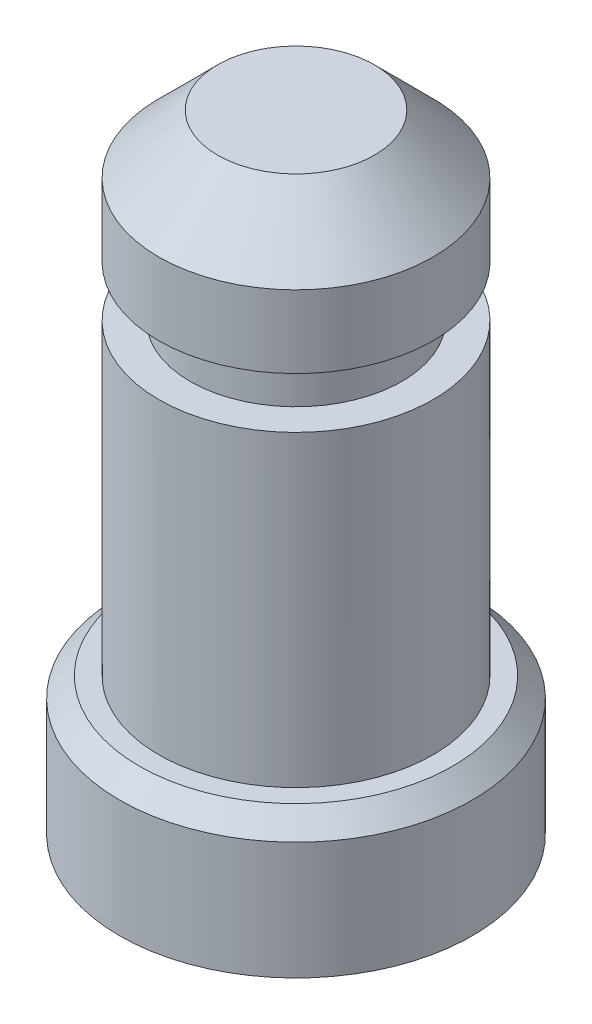
from build123d import *

# Parameters (mm, degrees)
SKETCH_1_R             = 3.5
EXTRUDE_1_DEPTH        = 8
SKETCH_2_W             = 1
SKETCH_2_H             = 3.5
HOLE_WIZARD_M4_1_D     = 3.3
HOLE_WIZARD_M4_1_DEPTH = 10.1
HOLE_WIZARD_M4_1_TIP   = 0.991420021
CHAMFER_1_SIZE         = 1.5
SKETCH_6_W             = 0.8
SKETCH_6_H             = 1.3
CHAMFER_2_SIZE         = 0.5


with BuildPart() as part:
    # 草图1 → 凸台-拉伸1 (new, symmetric)
    with BuildSketch(Plane(origin=(0, 0, 0), x_dir=(1, 0, 0), z_dir=(0, 1, 0))):
        with Locations(Location((0, 0, 0), (0, 0, 270))):
            Circle(SKETCH_1_R)
    extrude(amount=EXTRUDE_1_DEPTH, both=True)

    # 草图2 → 旋转1 (revolve)
    with BuildSketch(Plane.XY, mode=Mode.PRIVATE) as revolve_1_sk:
        with Locations((4, -6.25)):
            Rectangle(SKETCH_2_W, SKETCH_2_H)
    revolve(revolve_1_sk.sketch.rotate(Axis((0, 8, 0), (0, -1, 0)), 270), axis=Axis((0, 8, 0), (0, -1, 0)))

    # M4 螺纹孔1
    with Locations(Plane(origin=(0, -8, 0), x_dir=(-1, 0, 0), z_dir=(0, -1, 0))):
        with Locations((0, 0)):
            Hole(HOLE_WIZARD_M4_1_D / 2, depth=HOLE_WIZARD_M4_1_DEPTH)
            with Locations((0, 0, -(HOLE_WIZARD_M4_1_DEPTH + HOLE_WIZARD_M4_1_TIP / 2))):  # 118° drill point
                Cone(0, HOLE_WIZARD_M4_1_D / 2, HOLE_WIZARD_M4_1_TIP, mode=Mode.SUBTRACT)

    # 倒角1
    chamfer_1_edges = [part.edges().sort_by_distance(p)[0] for p in [
        (0, 8, -3.5),
    ]]
    chamfer(chamfer_1_edges, length=CHAMFER_1_SIZE)

    # 草图6 → 切除-旋转1 (revolve, cut)
    with BuildSketch(Plane.XY, mode=Mode.PRIVATE) as cut_revolve_1_sk:
        with Locations((3.1, 4)):
            Rectangle(SKETCH_6_W, SKETCH_6_H)
    revolve(cut_revolve_1_sk.sketch.rotate(Axis((0, 8, 0), (0, -1, 0)), 270), axis=Axis((0, 8, 0), (0, -1, 0)), mode=Mode.SUBTRACT)

    # 倒角2
    chamfer_2_edges = [part.edges().sort_by_distance(p)[0] for p in [
        (0, -4.5, 4.5),
    ]]
    chamfer(chamfer_2_edges, length=CHAMFER_2_SIZE)


solid = part.part
